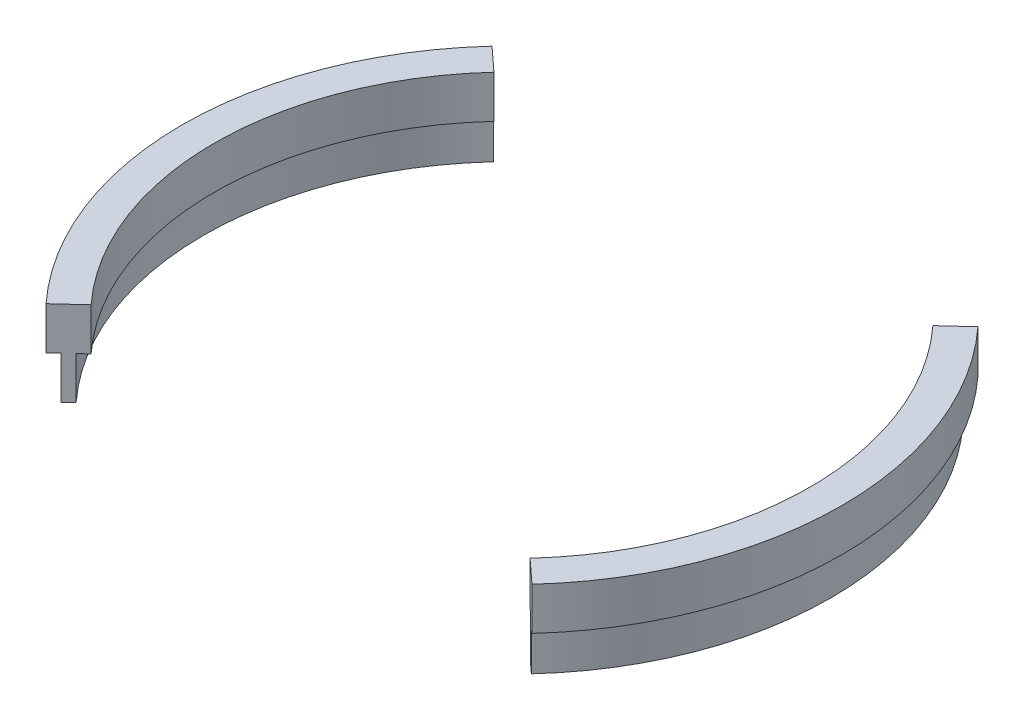
from build123d import *

# Parameters (mm, degrees)
BOSS_EXTRUDE1_DEPTH   = 4
BOSS_EXTRUDE1_2_DEPTH = 4
BOSS_EXTRUDE2_DEPTH   = 4


with BuildPart() as part:
    # Sketch1 → Boss-Extrude1 (new body)
    with BuildSketch(Plane(origin=(0, 0, 0), x_dir=(1, 0, 0), z_dir=(0, 1, 0))):
        with BuildLine():
            Line((-20.707420854, 3.458295902), (-19.970674607, 2.782126569))
            ThreePointArc((-19.970674607, 2.782126569), (-27.605033442, -16.8267841), (-19.970674607, -36.435694769))
            Line((-19.970674607, -36.435694769), (-20.707420854, -37.111864103))
            ThreePointArc((-20.707420854, -37.111864103), (-28.605033442, -16.8267841), (-20.707420854, 3.458295902))
        make_face()
    extrude(amount=BOSS_EXTRUDE1_DEPTH)



with BuildPart() as body_2:
    # Sketch1 → Boss-Extrude1 2 (new body)
    with BuildSketch(Plane(origin=(0, 0, 0), x_dir=(1, 0, 0), z_dir=(0, 1, 0))):
        with BuildLine():
            Line((22.760607722, -36.435694769), (23.497353969, -37.111864103))
            ThreePointArc((23.497353969, -37.111864103), (31.394966558, -16.8267841), (23.497353969, 3.458295902))
            Line((23.497353969, 3.458295902), (22.760607722, 2.782126569))
            ThreePointArc((22.760607722, 2.782126569), (30.394966558, -16.8267841), (22.760607722, -36.435694769))
        make_face()
    extrude(amount=BOSS_EXTRUDE1_2_DEPTH)


with BuildPart() as part_1:
    add(part.part)

    add(body_2.part)  # Boss-Extrude2 merges body 2
    # Sketch2 → Boss-Extrude2 (add)
    with BuildSketch(Plane(origin=(0, 4, 0), x_dir=(1, 0, 0), z_dir=(0, 1, 0))):
        with BuildLine():
            Line((-21.444167101, 4.134465235), (-19.23392836, 2.105957235))
            ThreePointArc((-19.23392836, 2.105957235), (-26.605033442, -16.8267841), (-19.23392836, -35.759525436))
            Line((-19.23392836, -35.759525436), (-21.444167101, -37.788033436))
            ThreePointArc((-21.444167101, -37.788033436), (-29.605033442, -16.8267841), (-21.444167101, 4.134465235))
        make_face()
        with BuildLine():
            Line((22.023861475, -35.759525436), (24.234100216, -37.788033436))
            ThreePointArc((24.234100216, -37.788033436), (32.394966558, -16.8267841), (24.234100216, 4.134465235))
            Line((24.234100216, 4.134465235), (22.023861475, 2.105957235))
            ThreePointArc((22.023861475, 2.105957235), (29.394966558, -16.8267841), (22.023861475, -35.759525436))
        make_face()
    extrude(amount=BOSS_EXTRUDE2_DEPTH)


solid = part_1.part
